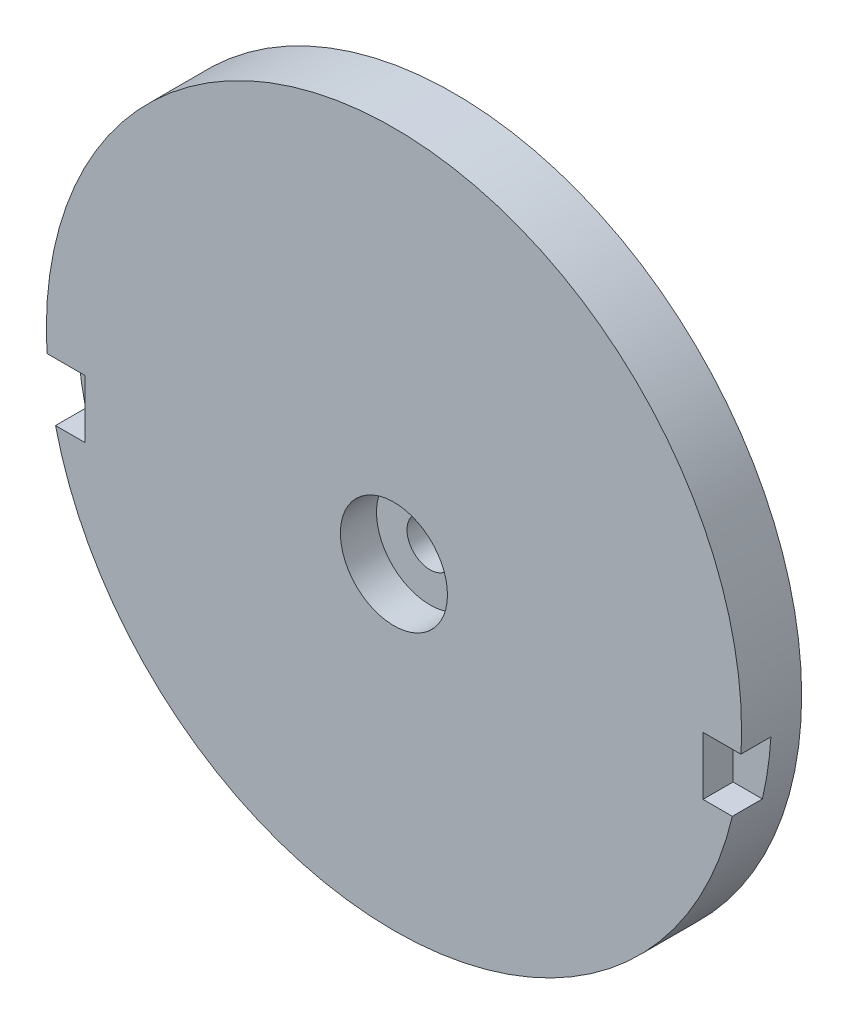
from build123d import *

# Parameters (mm, degrees)
SKETCH1_R           = 73.406
BOSS_EXTRUDE1_DEPTH = 12.7
CUT_EXTRUDE1_DEPTH  = 6.35
SKETCH3_R           = 11.303
CUT_EXTRUDE2_DEPTH  = 7.62
SKETCH4_R           = 4.8641
CUT_EXTRUDE3_DEPTH  = 105.585714474


with BuildPart() as part:
    # Sketch1 → Boss-Extrude1 (new body)
    with BuildSketch(Plane.XY):
        Circle(SKETCH1_R)
    extrude(amount=-BOSS_EXTRUDE1_DEPTH)

    # Sketch2 → Cut-Extrude1 (cut)
    with BuildSketch(Plane.XY):
        Polygon((-71.466139815, -4.4958), (-71.466139815, -16.764), (-65.268539815, -16.764), (-65.268539815, -4.4958), (-67.31, -4.4958), align=None)
        with BuildLine():
            ThreePointArc((-73.2681965, -4.4958), (-72.626676985, -10.668018845), (-71.466139815, -16.764))
            Line((-71.466139815, -16.764), (-71.466139815, -4.4958))
            Line((-71.466139815, -4.4958), (-73.2681965, -4.4958))
        make_face()
        Polygon((71.466139815, -16.764), (71.466139815, -4.4958), (67.31, -4.4958), (65.268539815, -4.4958), (65.268539815, -16.764), align=None)
        with BuildLine():
            Line((73.2681965, -4.4958), (71.466139815, -4.4958))
            Line((71.466139815, -4.4958), (71.466139815, -16.764))
            ThreePointArc((71.466139815, -16.764), (72.626676985, -10.668018845), (73.2681965, -4.4958))
        make_face()
    extrude(amount=-CUT_EXTRUDE1_DEPTH, mode=Mode.SUBTRACT)

    # Sketch3 → Cut-Extrude2 (cut)
    with BuildSketch(Plane.XY):
        with Locations((0, -6.35)):
            Circle(SKETCH3_R)
    extrude(amount=-CUT_EXTRUDE2_DEPTH, mode=Mode.SUBTRACT)

    # Sketch4 → Cut-Extrude3 (cut, through all)
    with BuildSketch(Plane.XY):
        with Locations((0, -6.35)):
            Circle(SKETCH4_R)
    extrude(amount=-CUT_EXTRUDE3_DEPTH, mode=Mode.SUBTRACT)


solid = part.part
